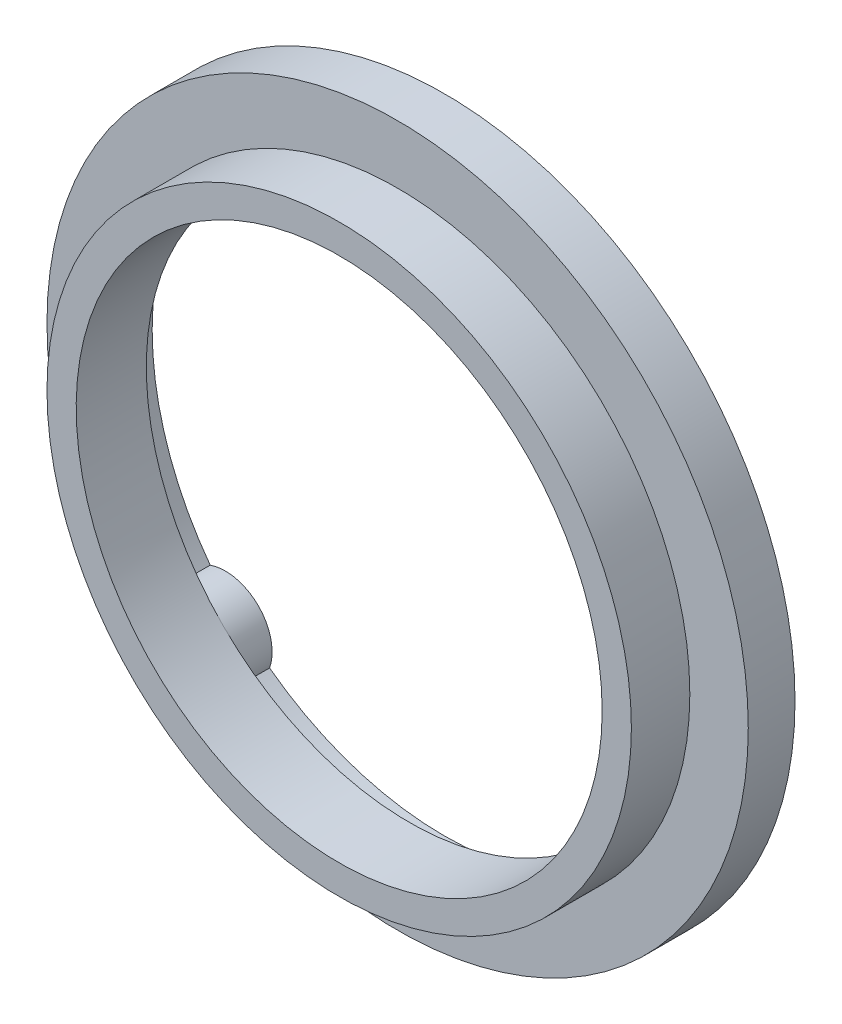
from build123d import *

# Parameters (mm, degrees)
EXTRUDE_1_DEPTH = 3
SKETCH_3_R      = 30
SKETCH_3_R_2    = 22.5
EXTRUDE_2_DEPTH = 1
SKETCH_4_R      = 25
SKETCH_4_R_2    = 22.5
EXTRUDE_3_DEPTH = 5


with BuildPart() as part:
    # 草图2 → 凸台-拉伸1 (new body)
    with BuildSketch(Plane.XY):
        with BuildLine():
            ThreePointArc((-116.606649797, -63.783530386), (-107.819853233, -84.996733821), (-86.606649797, -93.783530386))
            ThreePointArc((-86.606649797, -93.783530386), (-65.393446361, -84.996733821), (-56.606649797, -63.783530386))
            ThreePointArc((-56.606649797, -63.783530386), (-65.393446361, -42.57032695), (-86.606649797, -33.783530386))
            ThreePointArc((-86.606649797, -33.783530386), (-107.819853233, -42.57032695), (-116.606649797, -63.783530386))
        make_face()
        with BuildLine():
            ThreePointArc((-106.640989146, -48.829425703), (-102.516552374, -47.873627809), (-101.56075448, -43.749191037))
            ThreePointArc((-101.56075448, -43.749191037), (-86.606649797, -38.783530386), (-71.652545115, -43.749191037))
            ThreePointArc((-71.652545115, -43.749191037), (-70.69674722, -47.873627809), (-66.572310448, -48.829425703))
            ThreePointArc((-66.572310448, -48.829425703), (-61.606649797, -63.783530386), (-66.572310448, -78.737635068))
            ThreePointArc((-66.572310448, -78.737635068), (-70.69674722, -79.693432962), (-71.652545115, -83.817869734))
            ThreePointArc((-71.652545115, -83.817869734), (-86.606649797, -88.783530386), (-101.56075448, -83.817869734))
            ThreePointArc((-101.56075448, -83.817869734), (-102.516552374, -79.693432962), (-106.640989146, -78.737635068))
            ThreePointArc((-106.640989146, -78.737635068), (-111.606649797, -63.783530386), (-106.640989146, -48.829425703))
        make_face(mode=Mode.SUBTRACT)
    extrude(amount=EXTRUDE_1_DEPTH)

    # 草图3 → 凸台-拉伸2 (add)
    with BuildSketch(Plane.XY.offset(3)):
        with Locations((-86.606649797, -63.783530386)):
            Circle(SKETCH_3_R)
        with Locations(Location((-86.606649797, -63.783530386, 0), (0, 0, 135))):
            Circle(SKETCH_3_R_2, mode=Mode.SUBTRACT)
    extrude(amount=EXTRUDE_2_DEPTH)

    # 草图4 → 凸台-拉伸3 (add)
    with BuildSketch(Plane.XY.offset(4)):
        with Locations((-86.606649797, -63.783530386)):
            Circle(SKETCH_4_R)
        with Locations(Location((-86.606649797, -63.783530386, 0), (0, 0, 135))):
            Circle(SKETCH_4_R_2, mode=Mode.SUBTRACT)
    extrude(amount=EXTRUDE_3_DEPTH)


solid = part.part
